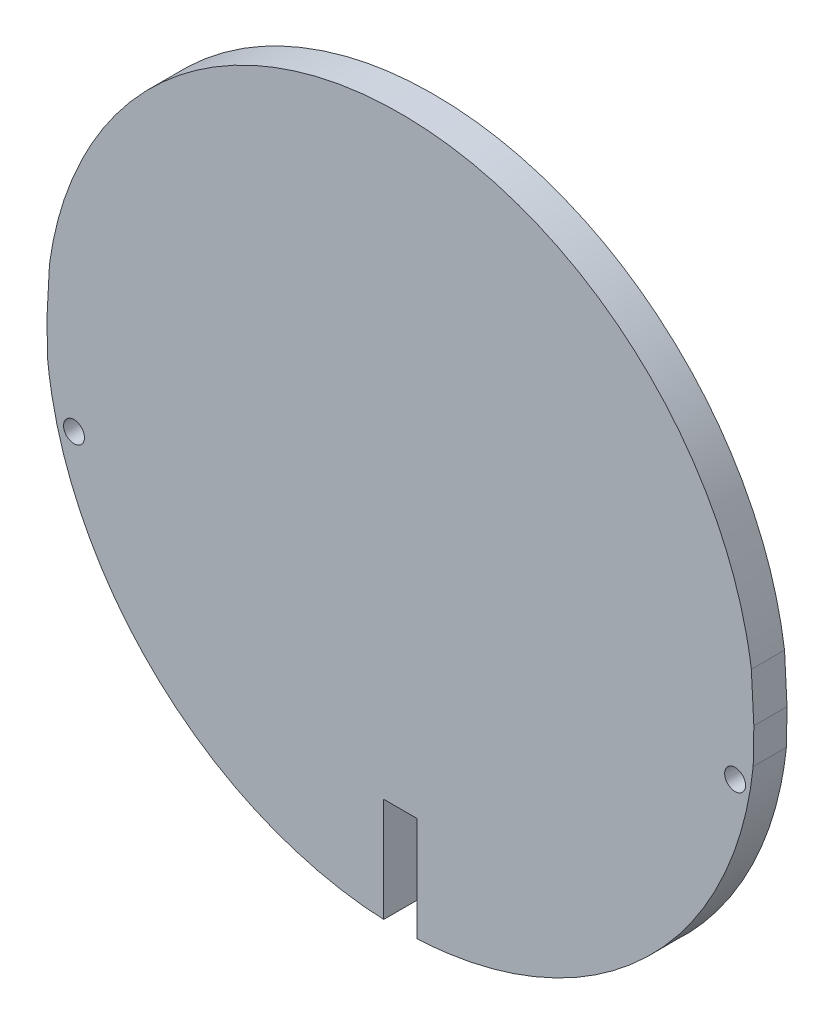
from build123d import *

# Parameters (mm, degrees)
BOSS_EXTRUDE1_DEPTH = 3.175
SKETCH4_R           = 1
CUT_EXTRUDE2_DEPTH  = 3.175
SKETCH5_W           = 3.175
SKETCH5_H           = 10.970571453
CUT_EXTRUDE3_DEPTH  = 48.905713025


with BuildPart() as part:
    # Sketch1 → Boss-Extrude1 (new body)
    with BuildSketch(Plane.XY.offset(240)):
        with BuildLine():
            Line((-33.799525455, -0.017072147), (-33.740147252, -3.418847174))
            add(Edge.make_bspline(
                [(-33.740147252, -3.418847174), (-33.521913435, -5.496739744), (-33.121758608, -7.52360336), (-32.245655467, -10.48651683), (-31.738647045, -11.948631126), (-31.127755378, -13.381606109), (-30.697366268, -14.330435347), (-30.470378572, -14.801900059), (-29.290211733, -17.119612441), (-27.644930506, -19.740333777), (-25.646898465, -22.113857284), (-24.588376817, -23.258919171), (-24.224726915, -23.634521718), (-23.482012785, -24.367327148), (-21.59014774, -26.150424449), (-18.705670827, -28.317861845), (-15.980786711, -29.823605713), (-14.107006772, -30.74768667), (-13.152701084, -31.164175695), (-10.256242476, -32.27934775), (-7.777960893, -32.988270972), (-5.214339656, -33.405899808), (-4.181967985, -33.549320099), (-3.661328308, -33.60925586), (-2.104532681, -33.751997759), (-1.069213869, -33.798542764), (2.029597644, -33.801687472), (4.085962141, -33.622116253), (7.155117004, -33.058726493), (8.178081257, -32.820670852), (10.177000978, -32.256577633), (11.158104767, -31.929888742), (14.04936497, -30.823232748), (15.907936031, -29.917809181), (18.13673294, -28.556406158), (18.576889104, -28.273087614), (19.438710135, -27.689460729), (20.706973253, -26.786573761), (21.903631517, -25.803366446), (23.438553372, -24.424422105), (24.544411843, -23.339363165), (25.578640539, -22.173955923), (26.251776296, -21.378677652), (26.580969723, -20.970778515), (28.17094662, -18.902925334), (29.269671397, -17.152899222), (30.678907287, -14.395868232), (31.108821176, -13.454846631), (31.884053374, -11.526054988), (32.230015293, -10.534907216), (33.119638114, -7.539302803), (33.521651228, -5.499562958), (33.740182048, -3.418847117)],
                knots=[0, 0, 0, 0, 0.0625, 0.0625, 0.09375, 0.109375, 0.109375, 0.125, 0.125, 0.1875, 0.21875, 0.21875, 0.234375, 0.234375, 0.25, 0.3125, 0.34375, 0.34375, 0.375, 0.375, 0.4375, 0.453125, 0.453125, 0.46875, 0.46875, 0.5, 0.5, 0.5625, 0.5625, 0.59375, 0.59375, 0.625, 0.625, 0.6875, 0.6875, 0.703125, 0.703125, 0.71875, 0.75, 0.75, 0.78125, 0.796875, 0.796875, 0.8125, 0.8125, 0.875, 0.875, 0.90625, 0.90625, 0.9375, 0.9375, 1, 1, 1, 1], degree=3))
            Line((33.740182048, -3.418847117), (33.799560251, -0.017072147))
            Line((33.799560251, -0.017072147), (33.560412457, 4.546139609))
            add(Edge.make_bspline(
                [(33.560412457, 4.546139609), (33.282065399, 6.567374379), (32.831372803, 8.534230691), (31.894626922, 11.402256897), (31.361087401, 12.815708643), (30.729491779, 14.19822173), (30.286610148, 15.113013144), (30.053701075, 15.567925007), (28.845742701, 17.805295292), (27.73617385, 19.487837269), (25.852855801, 21.84749908), (25.188593752, 22.606698061), (23.786460552, 24.069913543), (23.045059446, 24.776640829), (20.752328135, 26.778284029), (18.311067746, 28.558159122), (15.640647898, 29.995877244), (14.266739996, 30.656956524), (13.801141084, 30.868163008), (12.864758887, 31.267971853), (12.393699461, 31.456783193), (10.024605965, 32.347483289), (7.115279765, 33.1594713), (4.10232218, 33.57067126), (2.070213322, 33.754033964), (1.053662161, 33.799146951), (-1.978663229, 33.802802386), (-4.487220386, 33.587681269), (-6.97150073, 33.084409187), (-7.963243622, 32.859726611), (-8.459399615, 32.73533069), (-9.933669217, 32.329805435), (-10.897365307, 32.016750487), (-13.734609646, 30.957514861), (-15.554750033, 30.092235814), (-17.734673571, 28.798227251), (-18.165893543, 28.52880028), (-19.018645374, 27.968342063), (-19.439187613, 27.677889019), (-20.673952363, 26.783179445), (-21.465207676, 26.153069384), (-23.74871726, 24.167631397), (-25.151109466, 22.717611147), (-26.742507526, 20.734807748), (-27.053436756, 20.328702835), (-27.654958645, 19.504501759), (-28.525682186, 18.252011757), (-29.304349299, 16.952301265), (-30.745483656, 14.293275375), (-31.551336523, 12.44113352), (-32.506911863, 9.533039369), (-32.781055324, 8.547728647), (-33.237634192, 6.561909519), (-33.420905282, 5.558925362), (-33.560377664, 4.546139552)],
                knots=[0, 0, 0, 0, 0.0625, 0.0625, 0.09375, 0.109375, 0.109375, 0.125, 0.125, 0.1875, 0.1875, 0.21875, 0.21875, 0.25, 0.25, 0.3125, 0.34375, 0.34375, 0.359375, 0.359375, 0.375, 0.375, 0.4375, 0.46875, 0.46875, 0.5, 0.5, 0.5625, 0.578125, 0.578125, 0.59375, 0.59375, 0.625, 0.625, 0.6875, 0.6875, 0.703125, 0.703125, 0.71875, 0.71875, 0.75, 0.75, 0.8125, 0.8125, 0.828125, 0.828125, 0.84375, 0.875, 0.875, 0.9375, 0.9375, 0.96875, 0.96875, 1, 1, 1, 1], degree=3))
            Line((-33.560377664, 4.546139552), (-33.799525455, -0.017072147))
        make_face()
    extrude(amount=BOSS_EXTRUDE1_DEPTH)

    # Sketch4 → Cut-Extrude2 (cut)
    with BuildSketch(Plane.XY.offset(243.175)):
        with Locations((32.009302375, -5.358989516)):
            Circle(SKETCH4_R)
        with Locations((-31.216064399, -8.164436653)):
            Circle(SKETCH4_R)
    extrude(amount=-CUT_EXTRUDE2_DEPTH, mode=Mode.SUBTRACT)

    # Sketch5 → Cut-Extrude3 (cut, through all)
    with BuildSketch(Plane.XY.offset(243.175)):
        with Locations((-0.013127042, -29.284890239)):
            Rectangle(SKETCH5_W, SKETCH5_H)
    extrude(amount=-CUT_EXTRUDE3_DEPTH, mode=Mode.SUBTRACT)


solid = part.part
